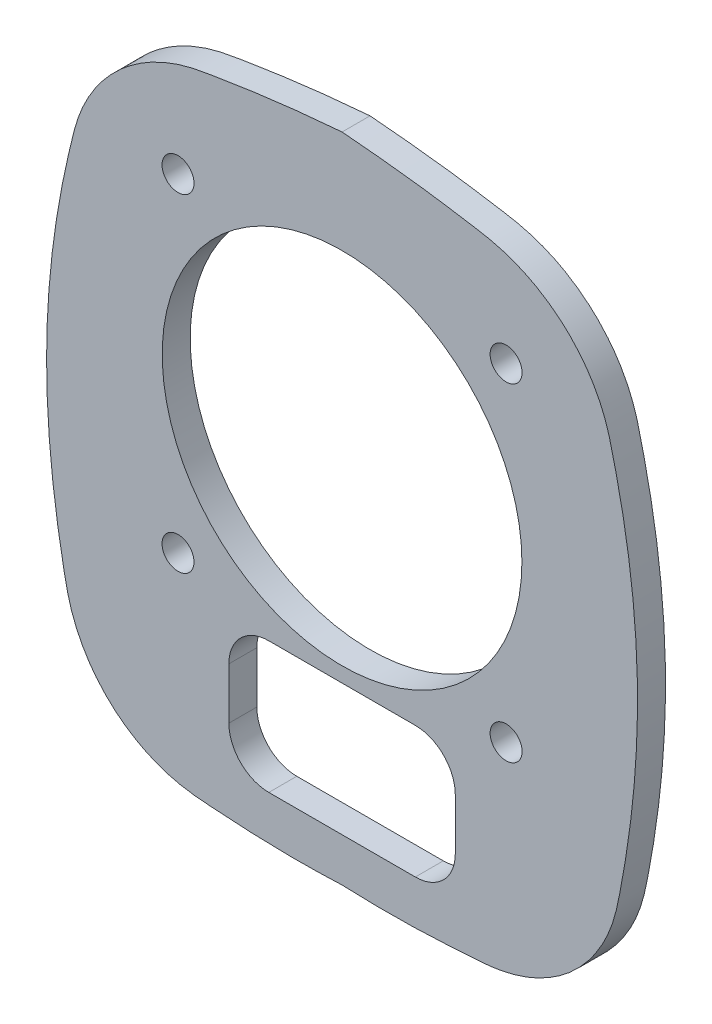
from build123d import *

# Parameters (mm, degrees)
SKETCH_1_R      = 1.6
SKETCH_1_R_2    = 18
EXTRUDE_1_DEPTH = 1.4


with BuildPart() as part:
    # Эскиз1 → Бобышка-Вытянуть1 (new, symmetric)
    with BuildSketch(Plane.XY):
        with BuildLine():
            add(Edge.make_bspline(
                [(0.000391324, 131.908854893), (-2.159126138, 131.734593086), (-5.393227429, 131.41853824), (-9.692894834, 130.848188184), (-12.365825019, 130.418323909), (-14.507991435, 130.079334897), (-16.733579072, 129.526910661), (-19.343191471, 128.415144728), (-22.155298871, 126.445152242), (-24.47523643, 123.899413856), (-25.887781921, 121.420218382), (-26.666214021, 119.255985972), (-27.182837519, 117.11960732), (-27.795881623, 114.484316509), (-28.404720613, 111.273449597), (-28.895174829, 108.045870016), (-29.376691101, 103.716956363), (-29.654218167, 98.276118357), (-29.490511231, 92.830584407), (-29.118436527, 88.495444968), (-28.720683244, 85.256152797), (-28.303226412, 82.575581978), (-27.908957151, 80.430881182), (-27.612318021, 78.848996026), (-27.206990177, 77.18157477), (-26.399807325, 75.051315901), (-24.951351248, 72.574600142), (-22.547723176, 70.083520788), (-19.624716733, 68.245956851), (-16.913856415, 67.323921415), (-14.638920021, 66.983806669), (-12.481262045, 66.835708127), (-9.7729952, 66.6563396), (-6.518615405, 66.54431302), (-3.258413178, 66.525369564), (-1.086482712, 66.595270615), (-0.001145903, 66.642388746)],
                knots=[-0.000627828, -0.000627828, -0.000627828, -0.000627828, 0.061889736, 0.093148518, 0.124407299, 0.14003669, 0.155666081, 0.186924863, 0.218183645, 0.249442427, 0.280701209, 0.2963306, 0.311959991, 0.343218773, 0.374477555, 0.405736337, 0.436995119, 0.499512683, 0.562030247, 0.593289029, 0.624547811, 0.655806592, 0.671435983, 0.687065374, 0.702694765, 0.718324156, 0.749582938, 0.78084172, 0.812100502, 0.843359284, 0.858988675, 0.874618066, 0.905876848, 0.93713563, 0.968394412, 0.999653194, 0.999653194, 0.999653194, 0.999653194], degree=3))
            add(Edge.make_bspline(
                [(-0.001145903, 66.642388746), (2.169485628, 66.541939863), (5.433851168, 66.505280539), (9.772002994, 66.656645222), (12.481746088, 66.835654069), (14.637680559, 66.983895816), (16.912912405, 67.323482487), (19.623646863, 68.245565621), (22.546474017, 70.082483087), (24.950276688, 72.573029911), (26.398979804, 75.050416605), (27.206558191, 77.178668305), (27.611018396, 78.848785228), (27.90936817, 80.430019986), (28.30250059, 82.572971882), (28.720541559, 85.254319913), (29.118155842, 88.49312803), (29.490390188, 92.828090448), (29.654253142, 98.273262844), (29.376905649, 103.713874927), (28.895642328, 108.04247797), (28.405276216, 111.27005664), (27.79676216, 114.480280639), (27.183484793, 117.116721422), (26.667552414, 119.250806559), (25.890129566, 121.4160718), (24.473485945, 123.902459514), (22.154711827, 126.445270685), (19.342461397, 128.415820489), (16.731474017, 129.527353104), (14.509433764, 130.079191823), (12.364494886, 130.418554538), (9.692618302, 130.848121132), (5.392732509, 131.419070179), (2.159365109, 131.732517865), (0.000391324, 131.908854893)],
                knots=[0.000346797, 0.000346797, 0.000346797, 0.000346797, 0.062864363, 0.094123147, 0.12538193, 0.141011322, 0.156640713, 0.187899497, 0.21915828, 0.250417063, 0.281675846, 0.297305238, 0.31293463, 0.328564021, 0.344193413, 0.375452196, 0.406710979, 0.437969763, 0.500487329, 0.563004896, 0.594263679, 0.625522462, 0.656781245, 0.688040029, 0.70366942, 0.719298812, 0.750557595, 0.781816378, 0.813075162, 0.844333945, 0.859963336, 0.875592728, 0.906851511, 0.938110295, 1.000627861, 1.000627861, 1.000627861, 1.000627861], degree=3))
        make_face()
        with Locations((16.417549031, 120.054494051)):
            Circle(SKETCH_1_R, mode=Mode.SUBTRACT)
        with Locations((0, 103.636945021)):
            Circle(SKETCH_1_R_2, mode=Mode.SUBTRACT)
        with Locations(Location((-16.416766384, 120.054494051, 0), (0, 0, 180))):
            Circle(SKETCH_1_R, mode=Mode.SUBTRACT)
        with Locations((-16.416766384, 87.21939599)):
            Circle(SKETCH_1_R, mode=Mode.SUBTRACT)
        with Locations(Location((16.417549031, 87.21939599, 0), (0, 0, 180))):
            Circle(SKETCH_1_R, mode=Mode.SUBTRACT)
        with BuildLine():
            Line((-7.330882536, 71.002350727), (7.331665183, 71.002350727))
            ThreePointArc((7.331665183, 71.002350727), (10.160092308, 72.173923602), (11.331665183, 75.002350727))
            Line((11.331665183, 75.002350727), (11.331665183, 80.143547066))
            ThreePointArc((11.331665183, 80.143547066), (10.160092308, 82.971974191), (7.331665183, 84.143547066))
            Line((7.331665183, 84.143547066), (-7.330882536, 84.143547066))
            ThreePointArc((-7.330882536, 84.143547066), (-10.15930966, 82.971974191), (-11.330882536, 80.143547066))
            Line((-11.330882536, 80.143547066), (-11.330882536, 75.002350727))
            ThreePointArc((-11.330882536, 75.002350727), (-10.15930966, 72.173923602), (-7.330882536, 71.002350727))
        make_face(mode=Mode.SUBTRACT)
    extrude(amount=EXTRUDE_1_DEPTH, both=True)


solid = part.part
